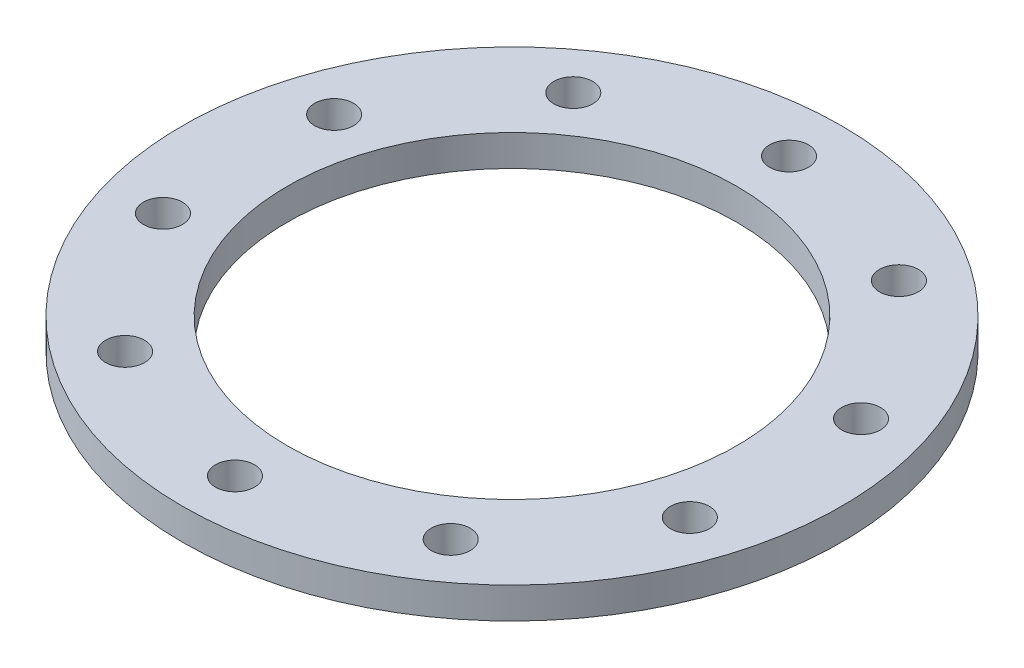
from build123d import *

# Parameters (mm, degrees)
SKETCH1_R           = 67.133194764
SKETCH1_R_2         = 45.789019651
BOSS_EXTRUDE1_DEPTH = 6.35
CUT_EXTRUDE1_REACH  = 97.153
SKETCH2_R           = 3.96875
CIRPATTERN1_COUNT   = 10


with BuildPart() as part:
    # Sketch1 → Boss-Extrude1 (new body)
    with BuildSketch(Plane(origin=(0, 0, 0), x_dir=(1, 0, 0), z_dir=(0, 1, 0))):
        with Locations(Location((0, 0, 0), (0, 0, 270))):
            Circle(SKETCH1_R)
        with Locations(Location((0, 0, 0), (0, 0, 270))):
            Circle(SKETCH1_R_2, mode=Mode.SUBTRACT)
    extrude(amount=BOSS_EXTRUDE1_DEPTH)

    # Sketch2 → Cut-Extrude1 (cut, up to next)
    with BuildSketch(Plane(origin=(0, 6.35, 0), x_dir=(1, 0, 0), z_dir=(0, 1, 0)), mode=Mode.PRIVATE) as cut_extrude1_sk1:
        with Locations(Location((0, 56.428647919, 0), (0, 0, 270))):
            Circle(SKETCH2_R)
    cut_extrude1_tool1 = extrude(cut_extrude1_sk1.sketch, amount=-CUT_EXTRUDE1_REACH, mode=Mode.PRIVATE) & part.part
    cut_extrude1 = cut_extrude1_tool1.solids().sort_by_distance((0, 6.35, -56.428648))[0]
    add(cut_extrude1, mode=Mode.SUBTRACT)

    # CirPattern1: Cut-Extrude1 ×10 about axis
    cirpattern1_axis = Axis((0, 0, 0), (0, 1, 0))
    for i in range(1, CIRPATTERN1_COUNT):
        add(cut_extrude1.rotate(cirpattern1_axis, i * 360 / CIRPATTERN1_COUNT), mode=Mode.SUBTRACT)


solid = part.part
